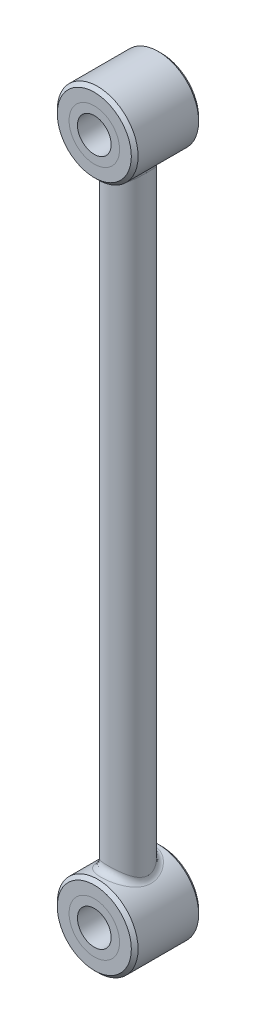
from build123d import *

# Parameters (mm, degrees)
SKETCH1_R             = 3
BOSS_EXTRUDE1_DEPTH   = 46
SKETCH2_R             = 6
SKETCH2_R_2           = 3.75
BOSS_EXTRUDE2_DEPTH   = 5
SKETCH3_R             = 3.75
SKETCH3_R_2           = 2.5
BOSS_EXTRUDE3_DEPTH   = 5
BOSS_EXTRUDE3_2_DEPTH = 5
FILLET1_R             = 1
CHAMFER2_SIZE         = 0.5


with BuildPart() as part:
    # Sketch1 → Boss-Extrude1 (new, symmetric)
    with BuildSketch(Plane(origin=(0, 0, 0), x_dir=(1, 0, 0), z_dir=(0, 1, 0))):
        with Locations(Location((0, 0, 0), (0, 0, 270))):
            Circle(SKETCH1_R)
    extrude(amount=BOSS_EXTRUDE1_DEPTH, both=True)

    # Sketch2 → Boss-Extrude2 (add, symmetric)
    # profile 1 of 2: a face of its own
    with BuildSketch(Plane.XY):
        with Locations((0, 51)):
            Circle(SKETCH2_R)
        with Locations((0, 51)):
            Circle(SKETCH2_R_2, mode=Mode.SUBTRACT)
    # profile 2 of 2: a face of its own
    with BuildSketch(Plane.XY):
        with Locations((0, -51)):
            Circle(SKETCH2_R)
        with Locations((0, -51)):
            Circle(SKETCH2_R_2, mode=Mode.SUBTRACT)
    extrude(amount=BOSS_EXTRUDE2_DEPTH, both=True)

    # Fillet1
    fillet1_edges = [part.edges().sort_by_distance(p)[0] for p in [
        (0, -45, -3.000000001),
        (0, 45, -3.000000001),
    ]]
    fillet(fillet1_edges, radius=FILLET1_R)

    # Chamfer2
    chamfer2_edges = [part.edges().sort_by_distance(p)[0] for p in [
        (-6, -51, -5),
        (-6, -51, 5),
        (-6, 51, -5),
        (-6, 51, 5),
    ]]
    chamfer(chamfer2_edges, length=CHAMFER2_SIZE)


with BuildPart() as body_2:
    # Sketch3 → Boss-Extrude3 (new, symmetric)
    with BuildSketch(Plane.XY):
        with Locations((0, 51)):
            Circle(SKETCH3_R)
        with Locations((0, 51)):
            Circle(SKETCH3_R_2, mode=Mode.SUBTRACT)
    extrude(amount=BOSS_EXTRUDE3_DEPTH, both=True)


with BuildPart() as body_3:
    # Sketch3 → Boss-Extrude3 2 (new, symmetric)
    with BuildSketch(Plane.XY):
        with Locations((0, -51)):
            Circle(SKETCH3_R)
        with Locations((0, -51)):
            Circle(SKETCH3_R_2, mode=Mode.SUBTRACT)
    extrude(amount=BOSS_EXTRUDE3_2_DEPTH, both=True)


solid = Compound([part.part, body_2.part, body_3.part])
